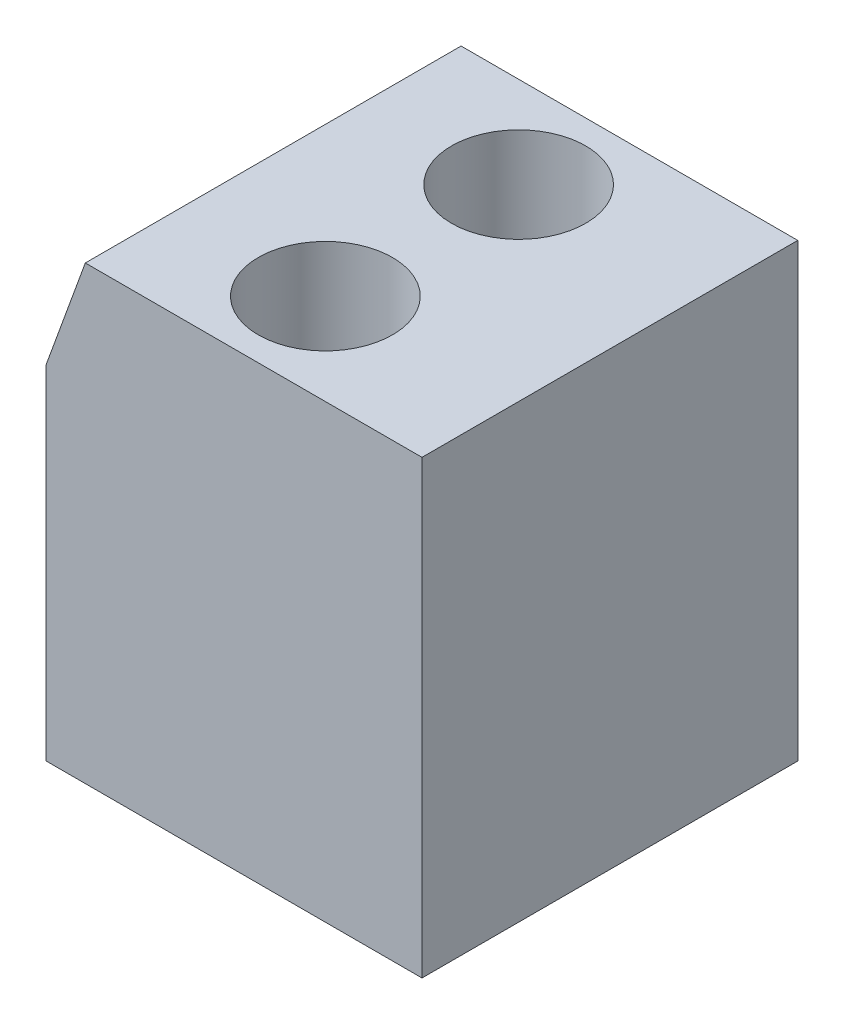
from build123d import *

# Parameters (mm, degrees)
ESQUISSE1_W             = 7
ESQUISSE1_H             = 7
BOSS_EXTRU_1_DEPTH      = 8.4
CHANFREIN1_SIZE         = 2
CHANFREIN1_SIZE2        = 0.727940469
ESQUISSE2_R             = 1.25
ENL_V_MAT_EXTRU_1_DEPTH = 4


with BuildPart() as part:
    # Esquisse1 → Boss.-Extru.1 (new body)
    with BuildSketch(Plane(origin=(0, 0, 0), x_dir=(1, 0, 0), z_dir=(0, 1, 0))):
        with Locations((3.5, -3.5)):
            Rectangle(ESQUISSE1_W, ESQUISSE1_H)
    extrude(amount=BOSS_EXTRU_1_DEPTH)

    # Chanfrein1
    chanfrein1_edges = [part.edges().sort_by_distance(p)[0] for p in [
        (0, 8.4, 3.5),
    ]]
    chanfrein1_side = [part.faces().sort_by_distance(p)[0] for p in [
        (0, 4.2, 3.5),
    ]]
    chamfer(chanfrein1_edges, length=CHANFREIN1_SIZE, length2=CHANFREIN1_SIZE2, reference=chanfrein1_side[0])

    # Esquisse2 → Enlèv. mat.-Extru.1 (cut)
    with BuildSketch(Plane(origin=(0, 8.4, 0), x_dir=(1, 0, 0), z_dir=(0, 1, 0))):
        with Locations(Location((3.5, -1.7, 0), (0, 0, 270))):
            Circle(ESQUISSE2_R)
        with Locations(Location((3.5, -5.3, 0), (0, 0, 270))):
            Circle(ESQUISSE2_R)
    extrude(amount=-ENL_V_MAT_EXTRU_1_DEPTH, mode=Mode.SUBTRACT)


solid = part.part
